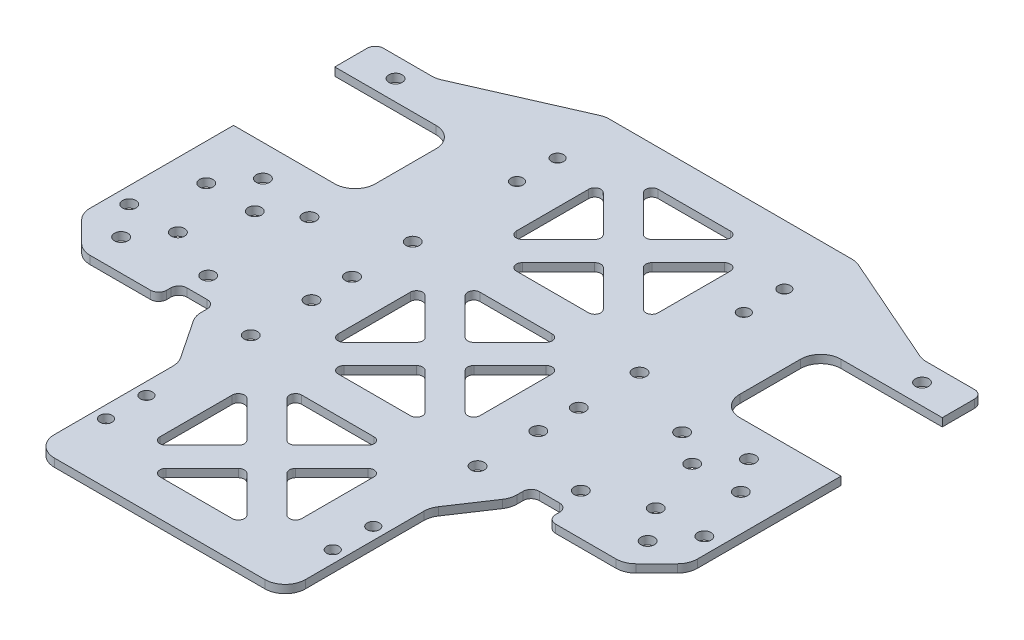
from build123d import *

# Parameters (mm, degrees)
SKETCH_1_W                     = 150
SKETCH_1_H                     = 141
EXTRUDE_1_DEPTH                = 2
CUT_EXTRUDE_1_REACH            = 104.953
SKETCH_2_R                     = 1.65
CUT_EXTRUDE_5_REACH            = 104.953
SKETCH_9_W                     = 44
SKETCH_9_H                     = 47.75
CUT_EXTRUDE_2_REACH            = 104.953
SKETCH_4_W                     = 9
SKETCH_4_H                     = 5
CUT_EXTRUDE_6_REACH            = 104.953
CHAMFER_1_SIZE                 = 8
CUT_EXTRUDE_3_REACH            = 104.953
SKETCH_5_R                     = 1.65
EXTRUDE_4_DEPTH                = 2
CUT_EXTRUDE_4_REACH            = 104.953
SKETCH_8_R                     = 1.5
CUT_EXTRUDE_7_REACH            = 104.953
SKETCH_11_W                    = 30
SKETCH_11_H                    = 25
FILLET_5_R                     = 5
FILLET_6_R                     = 2
CUT_EXTRUDE_8_REACH            = 104.953
SKETCH_12_R                    = 1.65
FILLET_7_R                     = 2
CUT_EXTRUDE_9_REACH            = 104.953
SKETCH_13_R                    = 1.65
CUT_EXTRUDE_11_REACH           = 104.953
SKETCH_14_R                    = 1.65
CUT_EXTRUDE_12_REACH           = 104.953
FILLET_8_R                     = 1.5
PATTERN_LINEAR_1_COUNT         = 2
PATTERN_LINEAR_1_PITCH         = 44
FILLET_8_OF_PATTERN_LINEAR_1_R = 1.5
PATTERN_LINEAR_2_COUNT         = 2
PATTERN_LINEAR_2_PITCH         = 44
FILLET_8_OF_PATTERN_LINEAR_2_R = 1.5


with BuildPart() as part:
    # 草图1 → 凸台-拉伸1 (new body)
    with BuildSketch(Plane(origin=(0, 0, 0), x_dir=(1, 0, 0), z_dir=(0, 1, 0))):
        Rectangle(SKETCH_1_W, SKETCH_1_H)
    extrude(amount=EXTRUDE_1_DEPTH)

    # 草图2 → 切除-拉伸1 (cut, up to next)
    with BuildSketch(Plane(origin=(0, 2, 0), x_dir=(1, 0, 0), z_dir=(0, 1, 0)), mode=Mode.PRIVATE) as cut_extrude_1_sk1:
        with Locations(Location((-60, 15, 0), (0, 0, 270))):
            Circle(SKETCH_2_R)
    cut_extrude_1_tool1 = extrude(cut_extrude_1_sk1.sketch, amount=-CUT_EXTRUDE_1_REACH, mode=Mode.PRIVATE) & part.part
    # 草图2 → 切除-拉伸1 (cut, up to next)
    with BuildSketch(Plane(origin=(0, 2, 0), x_dir=(1, 0, 0), z_dir=(0, 1, 0)), mode=Mode.PRIVATE) as cut_extrude_1_sk2:
        with Locations(Location((-66, 7, 0), (0, 0, 270))):
            Circle(SKETCH_2_R)
    cut_extrude_1_tool2 = extrude(cut_extrude_1_sk2.sketch, amount=-CUT_EXTRUDE_1_REACH, mode=Mode.PRIVATE) & part.part
    # 草图2 → 切除-拉伸1 (cut, up to next)
    with BuildSketch(Plane(origin=(0, 2, 0), x_dir=(1, 0, 0), z_dir=(0, 1, 0)), mode=Mode.PRIVATE) as cut_extrude_1_sk3:
        with Locations(Location((-54, 7, 0), (0, 0, 270))):
            Circle(SKETCH_2_R)
    cut_extrude_1_tool3 = extrude(cut_extrude_1_sk3.sketch, amount=-CUT_EXTRUDE_1_REACH, mode=Mode.PRIVATE) & part.part
    # 草图2 → 切除-拉伸1 (cut, up to next)
    with BuildSketch(Plane(origin=(0, 2, 0), x_dir=(1, 0, 0), z_dir=(0, 1, 0)), mode=Mode.PRIVATE) as cut_extrude_1_sk4:
        with Locations(Location((-71, -7, 0), (0, 0, 270))):
            Circle(SKETCH_2_R)
    cut_extrude_1_tool4 = extrude(cut_extrude_1_sk4.sketch, amount=-CUT_EXTRUDE_1_REACH, mode=Mode.PRIVATE) & part.part
    # 草图2 → 切除-拉伸1 (cut, up to next)
    with BuildSketch(Plane(origin=(0, 2, 0), x_dir=(1, 0, 0), z_dir=(0, 1, 0)), mode=Mode.PRIVATE) as cut_extrude_1_sk5:
        with Locations(Location((-59, -7, 0), (0, 0, 270))):
            Circle(SKETCH_2_R)
    cut_extrude_1_tool5 = extrude(cut_extrude_1_sk5.sketch, amount=-CUT_EXTRUDE_1_REACH, mode=Mode.PRIVATE) & part.part
    # 草图2 → 切除-拉伸1 (cut, up to next)
    with BuildSketch(Plane(origin=(0, 2, 0), x_dir=(1, 0, 0), z_dir=(0, 1, 0)), mode=Mode.PRIVATE) as cut_extrude_1_sk6:
        with Locations(Location((-65, -15, 0), (0, 0, 270))):
            Circle(SKETCH_2_R)
    cut_extrude_1_tool6 = extrude(cut_extrude_1_sk6.sketch, amount=-CUT_EXTRUDE_1_REACH, mode=Mode.PRIVATE) & part.part
    cut_extrude_1_1 = cut_extrude_1_tool1.solids().sort_by_distance((-60, 2, -15))[0]
    add(cut_extrude_1_1, mode=Mode.SUBTRACT)
    cut_extrude_1_2 = cut_extrude_1_tool2.solids().sort_by_distance((-66, 2, -7))[0]
    add(cut_extrude_1_2, mode=Mode.SUBTRACT)
    cut_extrude_1_3 = cut_extrude_1_tool3.solids().sort_by_distance((-54, 2, -7))[0]
    add(cut_extrude_1_3, mode=Mode.SUBTRACT)
    cut_extrude_1_4 = cut_extrude_1_tool4.solids().sort_by_distance((-71, 2, 7))[0]
    add(cut_extrude_1_4, mode=Mode.SUBTRACT)
    cut_extrude_1_5 = cut_extrude_1_tool5.solids().sort_by_distance((-59, 2, 7))[0]
    add(cut_extrude_1_5, mode=Mode.SUBTRACT)
    cut_extrude_1_6 = cut_extrude_1_tool6.solids().sort_by_distance((-65, 2, 15))[0]
    add(cut_extrude_1_6, mode=Mode.SUBTRACT)
    cut_extrude_1 = cut_extrude_1_1 + cut_extrude_1_2 + cut_extrude_1_3 + cut_extrude_1_4 + cut_extrude_1_5 + cut_extrude_1_6  # 切除-拉伸1 as one shape, for the pattern or mirror that repeats it

    # 草图9 → 切除-拉伸5 (cut, up to next)
    with BuildSketch(Plane(origin=(0, 2, 0), x_dir=(1, 0, 0), z_dir=(0, 1, 0)), mode=Mode.PRIVATE) as cut_extrude_5_sk1:
        with Locations((-53, -46.625)):
            Rectangle(SKETCH_9_W, SKETCH_9_H)
    cut_extrude_5_tool1 = extrude(cut_extrude_5_sk1.sketch, amount=-CUT_EXTRUDE_5_REACH, mode=Mode.PRIVATE) & part.part
    # 草图9 → 切除-拉伸5 (cut, up to next)
    with BuildSketch(Plane(origin=(0, 2, 0), x_dir=(1, 0, 0), z_dir=(0, 1, 0)), mode=Mode.PRIVATE) as cut_extrude_5_sk2:
        with Locations((53, -46.625)):
            Rectangle(SKETCH_9_W, SKETCH_9_H)
    cut_extrude_5_tool2 = extrude(cut_extrude_5_sk2.sketch, amount=-CUT_EXTRUDE_5_REACH, mode=Mode.PRIVATE) & part.part
    add(cut_extrude_5_tool1.solids().sort_by_distance((-53, 2, 46.625))[0], mode=Mode.SUBTRACT)
    add(cut_extrude_5_tool2.solids().sort_by_distance((53, 2, 46.625))[0], mode=Mode.SUBTRACT)

    # 草图4 → 切除-拉伸2 (cut, up to next)
    with BuildSketch(Plane(origin=(0, 2, 0), x_dir=(1, 0, 0), z_dir=(0, 1, 0)), mode=Mode.PRIVATE) as cut_extrude_2_sk1:
        with Locations((-43.5, -20.25)):
            Rectangle(SKETCH_4_W, SKETCH_4_H)
    cut_extrude_2_tool1 = extrude(cut_extrude_2_sk1.sketch, amount=-CUT_EXTRUDE_2_REACH, mode=Mode.PRIVATE) & part.part
    cut_extrude_2 = cut_extrude_2_tool1.solids().sort_by_distance((-43.5, 2, 20.25))[0]
    add(cut_extrude_2, mode=Mode.SUBTRACT)

    # 草图10 → 切除-拉伸6 (cut, up to next)
    with BuildSketch(Plane(origin=(0, 2, 0), x_dir=(1, 0, 0), z_dir=(0, 1, 0)), mode=Mode.PRIVATE) as cut_extrude_6_sk1:
        Polygon((-75, 70.5), (-31, 70.5), (-60, 57.75), (-75, 57.75), align=None)
    cut_extrude_6_tool1 = extrude(cut_extrude_6_sk1.sketch, amount=-CUT_EXTRUDE_6_REACH, mode=Mode.PRIVATE) & part.part
    cut_extrude_6 = cut_extrude_6_tool1.solids().sort_by_distance((-59.062147, 2, -65.169492))[0]
    add(cut_extrude_6, mode=Mode.SUBTRACT)

    # 镜向1: 切除-拉伸1, 切除-拉伸2, 切除-拉伸6 across plane
    add(cut_extrude_1.mirror(Plane(origin=(0, 0, 0), x_dir=(0, 0, 1), z_dir=(1, 0, 0))), mode=Mode.SUBTRACT)
    add(cut_extrude_2.mirror(Plane(origin=(0, 0, 0), x_dir=(0, 0, 1), z_dir=(1, 0, 0))), mode=Mode.SUBTRACT)
    add(cut_extrude_6.mirror(Plane(origin=(0, 0, 0), x_dir=(0, 0, 1), z_dir=(1, 0, 0))), mode=Mode.SUBTRACT)

    # 倒角1
    chamfer_1_edges = [part.edges().sort_by_distance(p)[0] for p in [
        (-75, 1, 22.75),
        (75, 1, 22.75),
    ]]
    chamfer(chamfer_1_edges, length=CHAMFER_1_SIZE)

    # 草图5 → 切除-拉伸3 (cut, up to next)
    with BuildSketch(Plane(origin=(0, 2, 0), x_dir=(1, 0, 0), z_dir=(0, 1, 0)), mode=Mode.PRIVATE) as cut_extrude_3_sk1:
        with Locations(Location((-28, 5, 0), (0, 0, 270))):
            Circle(SKETCH_5_R)
    cut_extrude_3_tool1 = extrude(cut_extrude_3_sk1.sketch, amount=-CUT_EXTRUDE_3_REACH, mode=Mode.PRIVATE) & part.part
    # 草图5 → 切除-拉伸3 (cut, up to next)
    with BuildSketch(Plane(origin=(0, 2, 0), x_dir=(1, 0, 0), z_dir=(0, 1, 0)), mode=Mode.PRIVATE) as cut_extrude_3_sk2:
        with Locations(Location((-28, -5, 0), (0, 0, 270))):
            Circle(SKETCH_5_R)
    cut_extrude_3_tool2 = extrude(cut_extrude_3_sk2.sketch, amount=-CUT_EXTRUDE_3_REACH, mode=Mode.PRIVATE) & part.part
    # 草图5 → 切除-拉伸3 (cut, up to next)
    with BuildSketch(Plane(origin=(0, 2, 0), x_dir=(1, 0, 0), z_dir=(0, 1, 0)), mode=Mode.PRIVATE) as cut_extrude_3_sk3:
        with Locations(Location((28, -5, 0), (0, 0, 270))):
            Circle(SKETCH_5_R)
    cut_extrude_3_tool3 = extrude(cut_extrude_3_sk3.sketch, amount=-CUT_EXTRUDE_3_REACH, mode=Mode.PRIVATE) & part.part
    # 草图5 → 切除-拉伸3 (cut, up to next)
    with BuildSketch(Plane(origin=(0, 2, 0), x_dir=(1, 0, 0), z_dir=(0, 1, 0)), mode=Mode.PRIVATE) as cut_extrude_3_sk4:
        with Locations(Location((28, 5, 0), (0, 0, 270))):
            Circle(SKETCH_5_R)
    cut_extrude_3_tool4 = extrude(cut_extrude_3_sk4.sketch, amount=-CUT_EXTRUDE_3_REACH, mode=Mode.PRIVATE) & part.part
    add(cut_extrude_3_tool1.solids().sort_by_distance((-28, 2, -5))[0], mode=Mode.SUBTRACT)
    add(cut_extrude_3_tool2.solids().sort_by_distance((-28, 2, 5))[0], mode=Mode.SUBTRACT)
    add(cut_extrude_3_tool3.solids().sort_by_distance((28, 2, 5))[0], mode=Mode.SUBTRACT)
    add(cut_extrude_3_tool4.solids().sort_by_distance((28, 2, -5))[0], mode=Mode.SUBTRACT)

    # 草图7 → 凸台-拉伸4 (add)
    with BuildSketch(Plane(origin=(0, 0, 0), x_dir=(1, 0, 0), z_dir=(0, 1, 0))):
        Polygon((-39, -22.75), (-31, -34.75), (-31, -22.75), align=None)
        Polygon((31, -22.75), (39, -22.75), (31, -34.75), align=None)
    extrude(amount=EXTRUDE_4_DEPTH)

    # 草图8 → 切除-拉伸4 (cut, up to next)
    with BuildSketch(Plane(origin=(0, 2, 0), x_dir=(1, 0, 0), z_dir=(0, 1, 0)), mode=Mode.PRIVATE) as cut_extrude_4_sk1:
        with Locations(Location((-28, -45.75, 0), (0, 0, 270))):
            Circle(SKETCH_8_R)
    cut_extrude_4_tool1 = extrude(cut_extrude_4_sk1.sketch, amount=-CUT_EXTRUDE_4_REACH, mode=Mode.PRIVATE) & part.part
    # 草图8 → 切除-拉伸4 (cut, up to next)
    with BuildSketch(Plane(origin=(0, 2, 0), x_dir=(1, 0, 0), z_dir=(0, 1, 0)), mode=Mode.PRIVATE) as cut_extrude_4_sk2:
        with Locations(Location((-28, -55.75, 0), (0, 0, 270))):
            Circle(SKETCH_8_R)
    cut_extrude_4_tool2 = extrude(cut_extrude_4_sk2.sketch, amount=-CUT_EXTRUDE_4_REACH, mode=Mode.PRIVATE) & part.part
    # 草图8 → 切除-拉伸4 (cut, up to next)
    with BuildSketch(Plane(origin=(0, 2, 0), x_dir=(1, 0, 0), z_dir=(0, 1, 0)), mode=Mode.PRIVATE) as cut_extrude_4_sk3:
        with Locations(Location((28, -45.75, 0), (0, 0, 270))):
            Circle(SKETCH_8_R)
    cut_extrude_4_tool3 = extrude(cut_extrude_4_sk3.sketch, amount=-CUT_EXTRUDE_4_REACH, mode=Mode.PRIVATE) & part.part
    # 草图8 → 切除-拉伸4 (cut, up to next)
    with BuildSketch(Plane(origin=(0, 2, 0), x_dir=(1, 0, 0), z_dir=(0, 1, 0)), mode=Mode.PRIVATE) as cut_extrude_4_sk4:
        with Locations(Location((28, -55.75, 0), (0, 0, 270))):
            Circle(SKETCH_8_R)
    cut_extrude_4_tool4 = extrude(cut_extrude_4_sk4.sketch, amount=-CUT_EXTRUDE_4_REACH, mode=Mode.PRIVATE) & part.part
    cut_extrude_4_1 = cut_extrude_4_tool1.solids().sort_by_distance((-28, 2, 45.75))[0]
    add(cut_extrude_4_1, mode=Mode.SUBTRACT)
    cut_extrude_4_2 = cut_extrude_4_tool2.solids().sort_by_distance((-28, 2, 55.75))[0]
    add(cut_extrude_4_2, mode=Mode.SUBTRACT)
    cut_extrude_4_3 = cut_extrude_4_tool3.solids().sort_by_distance((28, 2, 45.75))[0]
    add(cut_extrude_4_3, mode=Mode.SUBTRACT)
    cut_extrude_4_4 = cut_extrude_4_tool4.solids().sort_by_distance((28, 2, 55.75))[0]
    add(cut_extrude_4_4, mode=Mode.SUBTRACT)
    cut_extrude_4 = cut_extrude_4_1 + cut_extrude_4_2 + cut_extrude_4_3 + cut_extrude_4_4  # 切除-拉伸4 as one shape, for the pattern or mirror that repeats it

    # 草图11 → 切除-拉伸7 (cut, up to next)
    with BuildSketch(Plane(origin=(0, 2, 0), x_dir=(1, 0, 0), z_dir=(0, 1, 0)), mode=Mode.PRIVATE) as cut_extrude_7_sk1:
        with Locations((-60, 35.25)):
            Rectangle(SKETCH_11_W, SKETCH_11_H)
    cut_extrude_7_tool1 = extrude(cut_extrude_7_sk1.sketch, amount=-CUT_EXTRUDE_7_REACH, mode=Mode.PRIVATE) & part.part
    # 草图11 → 切除-拉伸7 (cut, up to next)
    with BuildSketch(Plane(origin=(0, 2, 0), x_dir=(1, 0, 0), z_dir=(0, 1, 0)), mode=Mode.PRIVATE) as cut_extrude_7_sk2:
        with Locations((60, 35.25)):
            Rectangle(SKETCH_11_W, SKETCH_11_H)
    cut_extrude_7_tool2 = extrude(cut_extrude_7_sk2.sketch, amount=-CUT_EXTRUDE_7_REACH, mode=Mode.PRIVATE) & part.part
    add(cut_extrude_7_tool1.solids().sort_by_distance((-60, 2, -35.25))[0], mode=Mode.SUBTRACT)
    add(cut_extrude_7_tool2.solids().sort_by_distance((60, 2, -35.25))[0], mode=Mode.SUBTRACT)

    # 镜向2: 切除-拉伸4 across plane
    add(cut_extrude_4.mirror(Plane.XY), mode=Mode.SUBTRACT)

    # 圆角5
    fillet_5_edges = [part.edges().sort_by_distance(p)[0] for p in [
        (39, 1, 22.75),
        (60, 1, -57.75),
        (31, 1, -70.5),
        (67, 1, 22.75),
        (75, 1, 14.75),
        (-75, 1, 14.75),
        (-67, 1, 22.75),
        (-31, 1, 34.75),
        (31, 1, 34.75),
        (-45, 1, -47.75),
        (-45, 1, -22.75),
        (45, 1, -22.75),
        (45, 1, -47.75),
        (-31, 1, 70.5),
        (31, 1, 70.5),
        (-39, 1, 22.75),
        (-31, 1, -70.5),
        (-60, 1, -57.75),
    ]]
    fillet(fillet_5_edges, radius=FILLET_5_R)

    # 圆角6
    fillet_6_edges = [part.edges().sort_by_distance(p)[0] for p in [
        (48, 1, 17.75),
        (48, 1, 22.75),
        (39, 1, 17.75),
        (-48, 1, 22.75),
        (-48, 1, 17.75),
        (-39, 1, 17.75),
    ]]
    fillet(fillet_6_edges, radius=FILLET_6_R)

    # 草图12 → 切除-拉伸8 (cut, up to next)
    with BuildSketch(Plane(origin=(0, 2, 0), x_dir=(1, 0, 0), z_dir=(0, 1, 0)), mode=Mode.PRIVATE) as cut_extrude_8_sk1:
        with Locations(Location((-65, 52.75, 0), (0, 0, 270))):
            Circle(SKETCH_12_R)
    cut_extrude_8_tool1 = extrude(cut_extrude_8_sk1.sketch, amount=-CUT_EXTRUDE_8_REACH, mode=Mode.PRIVATE) & part.part
    # 草图12 → 切除-拉伸8 (cut, up to next)
    with BuildSketch(Plane(origin=(0, 2, 0), x_dir=(1, 0, 0), z_dir=(0, 1, 0)), mode=Mode.PRIVATE) as cut_extrude_8_sk2:
        with Locations(Location((65, 52.75, 0), (0, 0, 90))):
            Circle(SKETCH_12_R)
    cut_extrude_8_tool2 = extrude(cut_extrude_8_sk2.sketch, amount=-CUT_EXTRUDE_8_REACH, mode=Mode.PRIVATE) & part.part
    add(cut_extrude_8_tool1.solids().sort_by_distance((-65, 2, -52.75))[0], mode=Mode.SUBTRACT)
    add(cut_extrude_8_tool2.solids().sort_by_distance((65, 2, -52.75))[0], mode=Mode.SUBTRACT)

    # 圆角7
    fillet_7_edges = [part.edges().sort_by_distance(p)[0] for p in [
        (75, 1, -57.75),
        (-75, 1, -57.75),
    ]]
    fillet(fillet_7_edges, radius=FILLET_7_R)

    # 草图13 → 切除-拉伸9 (cut, up to next)
    with BuildSketch(Plane(origin=(0, 2, 0), x_dir=(1, 0, 0), z_dir=(0, 1, 0)), mode=Mode.PRIVATE) as cut_extrude_9_sk1:
        with Locations(Location((-46, 12.5, 0), (0, 0, 270))):
            Circle(SKETCH_13_R)
    cut_extrude_9_tool1 = extrude(cut_extrude_9_sk1.sketch, amount=-CUT_EXTRUDE_9_REACH, mode=Mode.PRIVATE) & part.part
    # 草图13 → 切除-拉伸9 (cut, up to next)
    with BuildSketch(Plane(origin=(0, 2, 0), x_dir=(1, 0, 0), z_dir=(0, 1, 0)), mode=Mode.PRIVATE) as cut_extrude_9_sk2:
        with Locations(Location((-46, -12.5, 0), (0, 0, 270))):
            Circle(SKETCH_13_R)
    cut_extrude_9_tool2 = extrude(cut_extrude_9_sk2.sketch, amount=-CUT_EXTRUDE_9_REACH, mode=Mode.PRIVATE) & part.part
    # 草图13 → 切除-拉伸9 (cut, up to next)
    with BuildSketch(Plane(origin=(0, 2, 0), x_dir=(1, 0, 0), z_dir=(0, 1, 0)), mode=Mode.PRIVATE) as cut_extrude_9_sk3:
        with Locations(Location((46, 12.5, 0), (0, 0, 270))):
            Circle(SKETCH_13_R)
    cut_extrude_9_tool3 = extrude(cut_extrude_9_sk3.sketch, amount=-CUT_EXTRUDE_9_REACH, mode=Mode.PRIVATE) & part.part
    # 草图13 → 切除-拉伸9 (cut, up to next)
    with BuildSketch(Plane(origin=(0, 2, 0), x_dir=(1, 0, 0), z_dir=(0, 1, 0)), mode=Mode.PRIVATE) as cut_extrude_9_sk4:
        with Locations(Location((46, -12.5, 0), (0, 0, 270))):
            Circle(SKETCH_13_R)
    cut_extrude_9_tool4 = extrude(cut_extrude_9_sk4.sketch, amount=-CUT_EXTRUDE_9_REACH, mode=Mode.PRIVATE) & part.part
    add(cut_extrude_9_tool1.solids().sort_by_distance((-46, 2, -12.5))[0], mode=Mode.SUBTRACT)
    add(cut_extrude_9_tool2.solids().sort_by_distance((-46, 2, 12.5))[0], mode=Mode.SUBTRACT)
    add(cut_extrude_9_tool3.solids().sort_by_distance((46, 2, -12.5))[0], mode=Mode.SUBTRACT)
    add(cut_extrude_9_tool4.solids().sort_by_distance((46, 2, 12.5))[0], mode=Mode.SUBTRACT)

    # 草图14 → 切除-拉伸11 (cut, up to next)
    with BuildSketch(Plane(origin=(0, 2, 0), x_dir=(1, 0, 0), z_dir=(0, 1, 0)), mode=Mode.PRIVATE) as cut_extrude_11_sk1:
        with Locations(Location((-28, 20, 0), (0, 0, 270))):
            Circle(SKETCH_14_R)
    cut_extrude_11_tool1 = extrude(cut_extrude_11_sk1.sketch, amount=-CUT_EXTRUDE_11_REACH, mode=Mode.PRIVATE) & part.part
    # 草图14 → 切除-拉伸11 (cut, up to next)
    with BuildSketch(Plane(origin=(0, 2, 0), x_dir=(1, 0, 0), z_dir=(0, 1, 0)), mode=Mode.PRIVATE) as cut_extrude_11_sk2:
        with Locations(Location((28, 20, 0), (0, 0, 270))):
            Circle(SKETCH_14_R)
    cut_extrude_11_tool2 = extrude(cut_extrude_11_sk2.sketch, amount=-CUT_EXTRUDE_11_REACH, mode=Mode.PRIVATE) & part.part
    # 草图14 → 切除-拉伸11 (cut, up to next)
    with BuildSketch(Plane(origin=(0, 2, 0), x_dir=(1, 0, 0), z_dir=(0, 1, 0)), mode=Mode.PRIVATE) as cut_extrude_11_sk3:
        with Locations(Location((-28, -20, 0), (0, 0, 270))):
            Circle(SKETCH_14_R)
    cut_extrude_11_tool3 = extrude(cut_extrude_11_sk3.sketch, amount=-CUT_EXTRUDE_11_REACH, mode=Mode.PRIVATE) & part.part
    # 草图14 → 切除-拉伸11 (cut, up to next)
    with BuildSketch(Plane(origin=(0, 2, 0), x_dir=(1, 0, 0), z_dir=(0, 1, 0)), mode=Mode.PRIVATE) as cut_extrude_11_sk4:
        with Locations(Location((28, -20, 0), (0, 0, 270))):
            Circle(SKETCH_14_R)
    cut_extrude_11_tool4 = extrude(cut_extrude_11_sk4.sketch, amount=-CUT_EXTRUDE_11_REACH, mode=Mode.PRIVATE) & part.part
    add(cut_extrude_11_tool1.solids().sort_by_distance((-28, 2, -20))[0], mode=Mode.SUBTRACT)
    add(cut_extrude_11_tool2.solids().sort_by_distance((28, 2, -20))[0], mode=Mode.SUBTRACT)
    add(cut_extrude_11_tool3.solids().sort_by_distance((-28, 2, 20))[0], mode=Mode.SUBTRACT)
    add(cut_extrude_11_tool4.solids().sort_by_distance((28, 2, 20))[0], mode=Mode.SUBTRACT)

    # 草图15 → 切除-拉伸12 (cut, up to next)
    with BuildSketch(Plane(origin=(0, 2, 0), x_dir=(1, 0, 0), z_dir=(0, 1, 0)), mode=Mode.PRIVATE) as cut_extrude_12_sk1:
        Polygon((-17.5, -12.550252532), (-17.5, 12.550252532), (-4.949747468, 0), align=None)
    cut_extrude_12_tool1 = extrude(cut_extrude_12_sk1.sketch, amount=-CUT_EXTRUDE_12_REACH, mode=Mode.PRIVATE) & part.part
    # 草图15 → 切除-拉伸12 (cut, up to next)
    with BuildSketch(Plane(origin=(0, 2, 0), x_dir=(1, 0, 0), z_dir=(0, 1, 0)), mode=Mode.PRIVATE) as cut_extrude_12_sk2:
        Polygon((17.5, -12.550252532), (17.5, 12.550252532), (4.949747468, 0), align=None)
    cut_extrude_12_tool2 = extrude(cut_extrude_12_sk2.sketch, amount=-CUT_EXTRUDE_12_REACH, mode=Mode.PRIVATE) & part.part
    # 草图15 → 切除-拉伸12 (cut, up to next)
    with BuildSketch(Plane(origin=(0, 2, 0), x_dir=(1, 0, 0), z_dir=(0, 1, 0)), mode=Mode.PRIVATE) as cut_extrude_12_sk3:
        Polygon((-12.550252532, 17.5), (12.550252532, 17.5), (0, 4.949747468), align=None)
    cut_extrude_12_tool3 = extrude(cut_extrude_12_sk3.sketch, amount=-CUT_EXTRUDE_12_REACH, mode=Mode.PRIVATE) & part.part
    # 草图15 → 切除-拉伸12 (cut, up to next)
    with BuildSketch(Plane(origin=(0, 2, 0), x_dir=(1, 0, 0), z_dir=(0, 1, 0)), mode=Mode.PRIVATE) as cut_extrude_12_sk4:
        Polygon((-12.550252532, -17.5), (12.550252532, -17.5), (0, -4.949747468), align=None)
    cut_extrude_12_tool4 = extrude(cut_extrude_12_sk4.sketch, amount=-CUT_EXTRUDE_12_REACH, mode=Mode.PRIVATE) & part.part
    cut_extrude_12_1 = cut_extrude_12_tool1.solids().sort_by_distance((-13.316582, 2, 0))[0]
    add(cut_extrude_12_1, mode=Mode.SUBTRACT)
    cut_extrude_12_2 = cut_extrude_12_tool2.solids().sort_by_distance((13.316582, 2, 0))[0]
    add(cut_extrude_12_2, mode=Mode.SUBTRACT)
    cut_extrude_12_3 = cut_extrude_12_tool3.solids().sort_by_distance((0, 2, -13.316582))[0]
    add(cut_extrude_12_3, mode=Mode.SUBTRACT)
    cut_extrude_12_4 = cut_extrude_12_tool4.solids().sort_by_distance((0, 2, 13.316582))[0]
    add(cut_extrude_12_4, mode=Mode.SUBTRACT)
    cut_extrude_12 = cut_extrude_12_1 + cut_extrude_12_2 + cut_extrude_12_3 + cut_extrude_12_4  # 切除-拉伸12 as one shape, for the pattern or mirror that repeats it

    # 圆角8
    fillet_8_edges = [part.edges().sort_by_distance(p)[0] for p in [
        (0, 1, 4.949747468),
        (12.550252532, 1, 17.5),
        (-12.550252532, 1, 17.5),
        (-4.949747468, 1, 0),
        (-17.5, 1, 12.550252532),
        (-17.5, 1, -12.550252532),
        (0, 1, -4.949747468),
        (-12.550252532, 1, -17.5),
        (12.550252532, 1, -17.5),
        (4.949747468, 1, 0),
        (17.5, 1, -12.550252532),
        (17.5, 1, 12.550252532),
    ]]
    fillet(fillet_8_edges, radius=FILLET_8_R)

    # 阵列(线性)1: 切除-拉伸12 ×2
    with Locations(*[(0, 0, -i * PATTERN_LINEAR_1_PITCH) for i in range(1, PATTERN_LINEAR_1_COUNT)]):
        add(cut_extrude_12, mode=Mode.SUBTRACT)

    # 圆角8 of 阵列(线性)1
    fillet_8_of_pattern_linear_1_edges = [part.edges().sort_by_distance(p)[0] for p in [
        (0, 1, -39.050252532),
        (12.550252532, 1, -26.5),
        (-12.550252532, 1, -26.5),
        (-4.949747468, 1, -44),
        (-17.5, 1, -31.449747468),
        (-17.5, 1, -56.550252532),
        (0, 1, -48.949747468),
        (-12.550252532, 1, -61.5),
        (12.550252532, 1, -61.5),
        (4.949747468, 1, -44),
        (17.5, 1, -56.550252532),
        (17.5, 1, -31.449747468),
    ]]
    fillet(fillet_8_of_pattern_linear_1_edges, radius=FILLET_8_OF_PATTERN_LINEAR_1_R)

    # 阵列(线性)2: 切除-拉伸12 ×2
    with Locations(*[(0, 0, i * PATTERN_LINEAR_2_PITCH) for i in range(1, PATTERN_LINEAR_2_COUNT)]):
        add(cut_extrude_12, mode=Mode.SUBTRACT)

    # 圆角8 of 阵列(线性)2
    fillet_8_of_pattern_linear_2_edges = [part.edges().sort_by_distance(p)[0] for p in [
        (0, 1, 48.949747468),
        (12.550252532, 1, 61.5),
        (-12.550252532, 1, 61.5),
        (-4.949747468, 1, 44),
        (-17.5, 1, 56.550252532),
        (-17.5, 1, 31.449747468),
        (0, 1, 39.050252532),
        (-12.550252532, 1, 26.5),
        (12.550252532, 1, 26.5),
        (4.949747468, 1, 44),
        (17.5, 1, 31.449747468),
        (17.5, 1, 56.550252532),
    ]]
    fillet(fillet_8_of_pattern_linear_2_edges, radius=FILLET_8_OF_PATTERN_LINEAR_2_R)


solid = part.part
